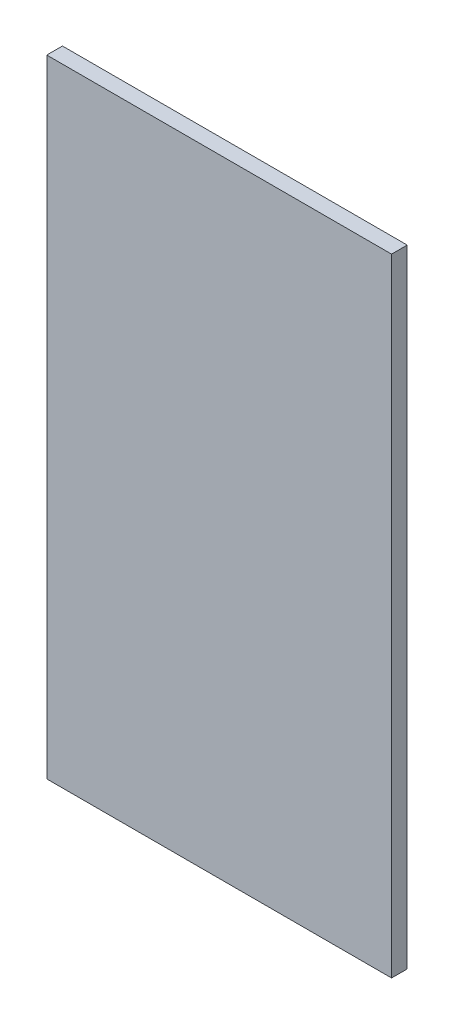
from build123d import *

# Parameters (mm, degrees)
SKETCH1_W           = 139.7
SKETCH1_H           = 254
BOSS_EXTRUDE1_DEPTH = 6.35


with BuildPart() as part:
    # Sketch1 → Boss-Extrude1 (new body)
    with BuildSketch(Plane.XY):
        with Locations((384.175, 114.3)):
            Rectangle(SKETCH1_W, SKETCH1_H)
    extrude(amount=BOSS_EXTRUDE1_DEPTH)


solid = part.part
